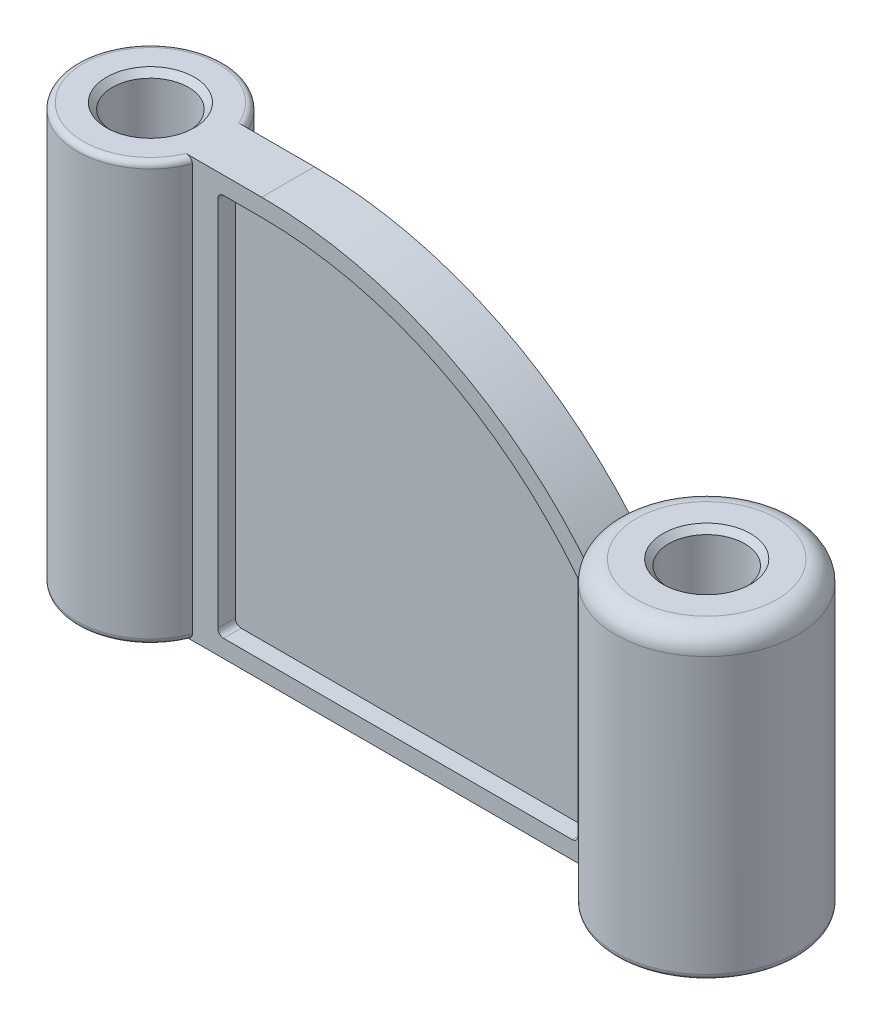
from build123d import *

# Parameters (mm, degrees)
SKETCH1_W                = 18
SKETCH1_H                = 103
SKETCH3_W                = 12
SKETCH3_H                = 143
CHAMFER1_SIZE            = 2
CHAMFER2_SIZE            = 2
FILLET1_R                = 2
FILLET2_R                = 2
FILLET3_R                = 7
BOSS_EXTRUDE1_DEPTH      = 9
BOSS_EXTRUDE1_DEPTH_BACK = 9
CUT_EXTRUDE1_DEPTH       = 6


with BuildPart() as part:
    # Sketch1 → Revolve2 (revolve)
    with BuildSketch(Plane.XY):
        with Locations((165, 51.5)):
            Rectangle(SKETCH1_W, SKETCH1_H)
    revolve(axis=Axis((143, 0, 0), (0, 1, 0)))

    # Chamfer2
    chamfer2_edges = [part.edges().sort_by_distance(p)[0] for p in [
        (130, 103, 0),
        (130, 0, 0),
    ]]
    chamfer(chamfer2_edges, length=CHAMFER2_SIZE)

    # Fillet2
    fillet2_edges = [part.edges().sort_by_distance(p)[0] for p in [
        (112, 0, 0),
    ]]
    fillet(fillet2_edges, radius=FILLET2_R)

    # Fillet3
    fillet3_edges = [part.edges().sort_by_distance(p)[0] for p in [
        (112, 103, 0),
    ]]
    fillet(fillet3_edges, radius=FILLET3_R)



with BuildPart() as body_2:
    # Sketch3 → Revolve3 (revolve)
    with BuildSketch(Plane.XY):
        with Locations((-66, 71.5)):
            Rectangle(SKETCH3_W, SKETCH3_H)
    revolve(axis=Axis((-47, 0, 0), (0, 1, 0)))

    # Chamfer1
    chamfer1_edges = [body_2.edges().sort_by_distance(p)[0] for p in [
        (-34, 0, 0),
        (-34, 143, 0),
    ]]
    chamfer(chamfer1_edges, length=CHAMFER1_SIZE)

    # Fillet1
    fillet1_edges = [body_2.edges().sort_by_distance(p)[0] for p in [
        (-22, 143, 0),
        (-22, 0, 0),
    ]]
    fillet(fillet1_edges, radius=FILLET1_R)


with BuildPart() as part_1:
    add(part.part)

    add(body_2.part)  # Boss-Extrude1 merges body 2
    # Sketch4 → Boss-Extrude1 (add, two sides: drawn at the far end of the back side and taken through both)
    with BuildSketch(Plane.XY.offset(-BOSS_EXTRUDE1_DEPTH_BACK)):
        with BuildLine():
            Line((0, 0), (-27.193276933, 0))
            Line((-27.193276933, 0), (-27.193276933, 143))
            Line((-27.193276933, 143), (0, 143))
            ThreePointArc((0, 143), (69.368060127, 125.048279613), (121.319672434, 75.700310967))
            Line((121.319672434, 75.700310967), (121.319672434, 0))
            Line((121.319672434, 0), (0, 0))
        make_face()
    extrude(amount=BOSS_EXTRUDE1_DEPTH + BOSS_EXTRUDE1_DEPTH_BACK)

    # Sketch6 → Cut-Extrude1 (cut)
    with BuildSketch(Plane.XY.offset(9)):
        with BuildLine():
            Line((0, 137), (-13, 137))
            ThreePointArc((-13, 137), (-14.414213562, 136.414213562), (-15, 135))
            Line((-15, 135), (-15, 8))
            ThreePointArc((-15, 8), (-14.414213562, 6.585786438), (-13, 6))
            Line((-13, 6), (106, 6))
            ThreePointArc((106, 6), (107.414213562, 6.585786438), (108, 8))
            Line((108, 8), (108, 83.600239234))
            ThreePointArc((108, 83.600239234), (107.889542371, 84.255700621), (107.57037037, 84.838761297))
            ThreePointArc((107.57037037, 84.838761297), (59.774951704, 123.27187493), (0, 137))
        make_face()
    cut_extrude1 = extrude(amount=-CUT_EXTRUDE1_DEPTH, mode=Mode.SUBTRACT)

    # Mirror1: Cut-Extrude1 across plane
    add(cut_extrude1.mirror(Plane.XY), mode=Mode.SUBTRACT)


solid = part_1.part
